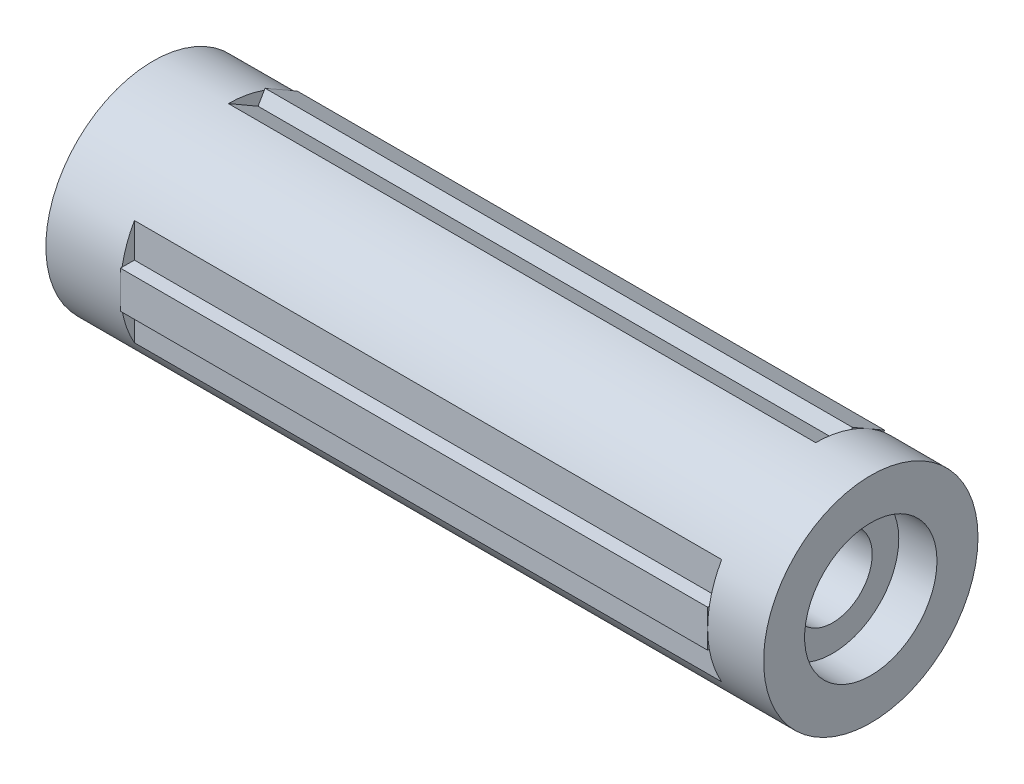
from build123d import *

# Parameters (mm, degrees)
SKIZZE1_R                       = 11.5
AUFSATZ_LINEAR_AUSTRAGEN1_DEPTH = 77
SKIZZE2_R                       = 7.1
SCHNITT_LINEAR_AUSTRAGEN1_DEPTH = 4.1
SKIZZE3_R                       = 4.25
SCHNITT_LINEAR_AUSTRAGEN2_DEPTH = 43
SKIZZE4_R                       = 9.6
SCHNITT_LINEAR_AUSTRAGEN3_DEPTH = 12.75
SCHNITT_LINEAR_START            = -6
SKIZZE7_W                       = 1.5
SKIZZE7_H                       = 15
SCHNITT_LINEAR_AUSTRAGEN4_DEPTH = 63
SKIZZE8_W                       = 63
SKIZZE8_H                       = 4
AUFSATZ_LINEAR_AUSTRAGEN2_DEPTH = 1.5
SCHNITT_LINEAR_AUSTRAGEN6_DEPTH = 13.5
SKIZZE12_R                      = 3
SCHNITT_LINEAR_AUSTRAGEN7_DEPTH = 2
KREISMUSTER3_COUNT              = 3


with BuildPart() as part:
    # Skizze1 → Aufsatz-Linear austragen1 (new body)
    with BuildSketch(Plane(origin=(0, 0, 0), x_dir=(0, 0, -1), z_dir=(1, 0, 0))):
        Circle(SKIZZE1_R)
    extrude(amount=AUFSATZ_LINEAR_AUSTRAGEN1_DEPTH)

    # Skizze2 → Schnitt-Linear austragen1 (cut)
    with BuildSketch(Plane(origin=(77, 0, 0), x_dir=(0, 0, -1), z_dir=(1, 0, 0))):
        Circle(SKIZZE2_R)
    extrude(amount=-SCHNITT_LINEAR_AUSTRAGEN1_DEPTH, mode=Mode.SUBTRACT)

    # Skizze3 → Schnitt-Linear austragen2 (cut)
    with BuildSketch(Plane(origin=(72.9, 0, 0), x_dir=(0, 0, -1), z_dir=(1, 0, 0))):
        Circle(SKIZZE3_R)
    extrude(amount=-SCHNITT_LINEAR_AUSTRAGEN2_DEPTH, mode=Mode.SUBTRACT)

    # Skizze4 → Schnitt-Linear austragen3 (cut)
    with BuildSketch(Plane.ZY):
        Circle(SKIZZE4_R)
    extrude(amount=-SCHNITT_LINEAR_AUSTRAGEN3_DEPTH, mode=Mode.SUBTRACT)

    # Skizze7 → Schnitt-Linear austragen4 (cut)
    with BuildSketch(Plane(origin=(77, 0, 0), x_dir=(0, 0, -1), z_dir=(1, 0, 0)).offset(SCHNITT_LINEAR_START)):
        with Locations((-10.75, 0)):
            Rectangle(SKIZZE7_W, SKIZZE7_H)
    schnitt_linear_austragen4 = extrude(amount=-SCHNITT_LINEAR_AUSTRAGEN4_DEPTH, mode=Mode.SUBTRACT)

    # Skizze8 → Aufsatz-Linear austragen2 (add)
    with BuildSketch(Plane.XY.offset(10)):
        with Locations((39.5, 0)):
            Rectangle(SKIZZE8_W, SKIZZE8_H)
    aufsatz_linear_austragen2 = extrude(amount=AUFSATZ_LINEAR_AUSTRAGEN2_DEPTH)

    # Skizze10 → Schnitt-Linear austragen6 (cut)
    with BuildSketch(Plane.ZY.offset(-12.75)):
        Polygon((4.038863706, -2.240739453), (3.959969143, 2.377388845), (-0.078894563, 4.618128298), (-4.038863706, 2.240739453), (-3.959969143, -2.377388845), (0.078894563, -4.618128298), align=None)
    extrude(amount=-SCHNITT_LINEAR_AUSTRAGEN6_DEPTH, mode=Mode.SUBTRACT)

    # Skizze12 → Schnitt-Linear austragen7 (cut)
    with BuildSketch(Plane.ZY.offset(-26.25)):
        Circle(SKIZZE12_R)
    extrude(amount=-SCHNITT_LINEAR_AUSTRAGEN7_DEPTH, mode=Mode.SUBTRACT)

    # Kreismuster3: Schnitt-Linear austragen4, Aufsatz-Linear austragen2 ×3 about axis
    kreismuster3_axis = Axis((0, 0, 0), (1, 0, 0))
    add([schnitt_linear_austragen4.rotate(kreismuster3_axis, i * 360 / KREISMUSTER3_COUNT) for i in range(1, KREISMUSTER3_COUNT)], mode=Mode.SUBTRACT)
    add([aufsatz_linear_austragen2.rotate(kreismuster3_axis, i * 360 / KREISMUSTER3_COUNT) for i in range(1, KREISMUSTER3_COUNT)])


solid = part.part
